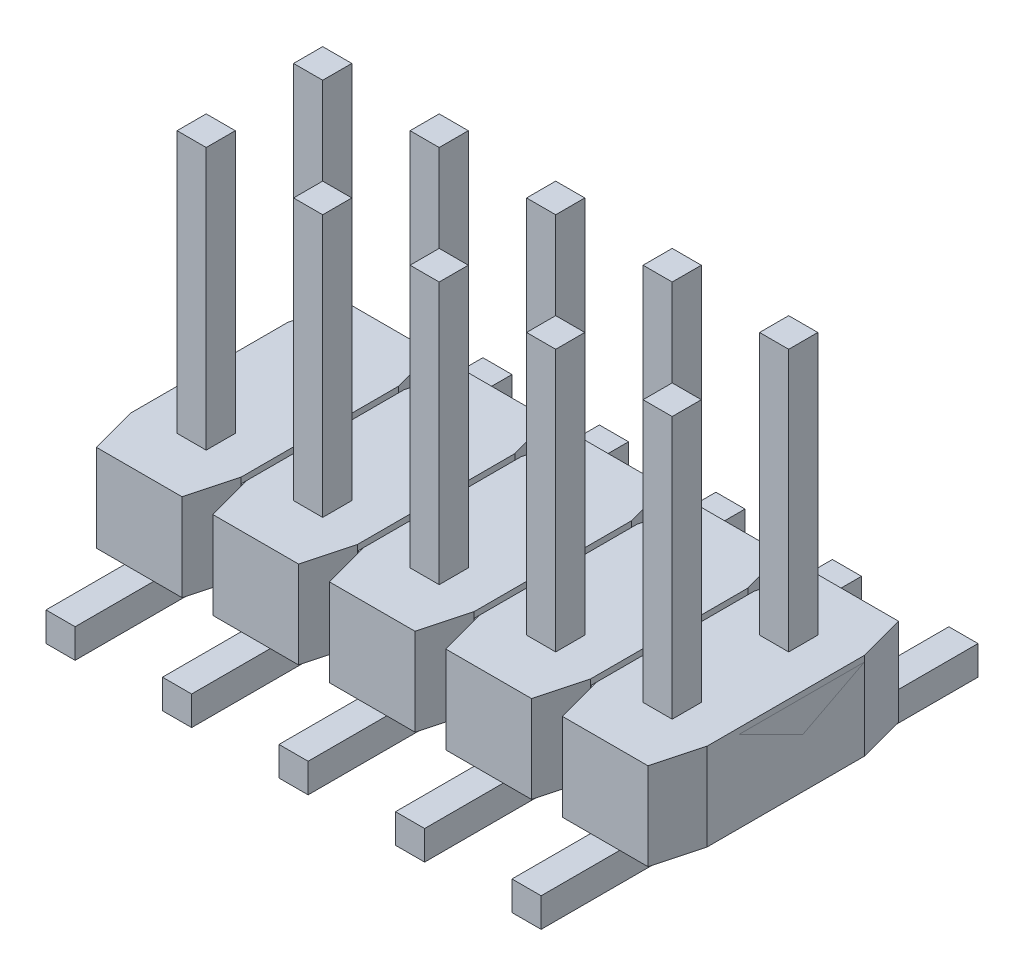
from build123d import *

# Parameters (mm, degrees)
CROQUIS1_W       = 0.5
CROQUIS1_H       = 0.5
EXTRUIR1_DEPTH   = 6.5
CROQUIS2_W       = 0.5
CROQUIS2_H       = 7.5
EXTRUIR2_DEPTH   = 0.5
CROQUIS3_W       = 0.5
CROQUIS3_H       = 0.5
EXTRUIR4_DEPTH   = 1.5
EXTRUIR4_2_DEPTH = 1.5
EXTRUIR4_3_DEPTH = 1.5
EXTRUIR4_4_DEPTH = 1.5
EXTRUIR4_5_DEPTH = 1.5
CROQUIS4_W       = 9.9
CROQUIS4_H       = 2.7
EXTRUIR5_DEPTH   = 1.4


with BuildPart() as part:
    # Croquis1 → Extruir1 (new body)
    with BuildSketch(Plane(origin=(0, 0, 0), x_dir=(1, 0, 0), z_dir=(0, 1, 0))):
        with Locations((2.25, 0.25)):
            Rectangle(CROQUIS1_W, CROQUIS1_H)
        with Locations((0.25, 0.25)):
            Rectangle(CROQUIS1_W, CROQUIS1_H)
        with Locations((4.25, 0.25)):
            Rectangle(CROQUIS1_W, CROQUIS1_H)
        with Locations((6.25, 0.25)):
            Rectangle(CROQUIS1_W, CROQUIS1_H)
        with Locations((8.25, 0.25)):
            Rectangle(CROQUIS1_W, CROQUIS1_H)
        with Locations((0.25, 2.25)):
            Rectangle(CROQUIS1_W, CROQUIS1_H)
        with Locations((2.25, 2.25)):
            Rectangle(CROQUIS1_W, CROQUIS1_H)
        with Locations((4.25, 2.25)):
            Rectangle(CROQUIS1_W, CROQUIS1_H)
        with Locations((6.25, 2.25)):
            Rectangle(CROQUIS1_W, CROQUIS1_H)
        with Locations((8.25, 2.25)):
            Rectangle(CROQUIS1_W, CROQUIS1_H)
    extrude(amount=EXTRUIR1_DEPTH)

    # Croquis2 → Extruir2 (add)
    with BuildSketch(Plane.XZ):
        with Locations((2.25, -1.5)):
            Rectangle(CROQUIS2_W, CROQUIS2_H)
        with Locations((0.25, -1.5)):
            Rectangle(CROQUIS2_W, CROQUIS2_H)
        with Locations((4.25, -1.5)):
            Rectangle(CROQUIS2_W, CROQUIS2_H)
        with Locations((6.25, -1.5)):
            Rectangle(CROQUIS2_W, CROQUIS2_H)
        with Locations((8.25, -1.5)):
            Rectangle(CROQUIS2_W, CROQUIS2_H)
    extrude(amount=-EXTRUIR2_DEPTH)


with BuildPart() as body_2:
    # Croquis3 → Extruir4 (new body)
    with BuildSketch(Plane(origin=(0, 0.5, 0), x_dir=(-1, 0, 0), z_dir=(0, 1, 0))):
        Polygon((-0.985640646, -3.4), (0.485640646, -3.4), (0.7, -2.6), (0.7, 0.1), (0.485640646, 0.9), (-0.985640646, 0.9), (-1.2, 0.1), (-1.2, -2.6), align=None)
        with Locations((-0.25, -2.25)):
            Rectangle(CROQUIS3_W, CROQUIS3_H, mode=Mode.SUBTRACT)
        with Locations((-0.25, -0.25)):
            Rectangle(CROQUIS3_W, CROQUIS3_H, mode=Mode.SUBTRACT)
    extrude(amount=EXTRUIR4_DEPTH)


with BuildPart() as body_3:
    # Croquis3 → Extruir4 2 (new body)
    with BuildSketch(Plane(origin=(0, 0.5, 0), x_dir=(-1, 0, 0), z_dir=(0, 1, 0))):
        Polygon((-2.985640646, -3.4), (-1.514359354, -3.4), (-1.3, -2.6), (-1.3, 0.1), (-1.514359354, 0.9), (-2.985640646, 0.9), (-3.2, 0.1), (-3.2, -2.6), align=None)
        with Locations((-2.25, -2.25)):
            Rectangle(CROQUIS3_W, CROQUIS3_H, mode=Mode.SUBTRACT)
        with Locations((-2.25, -0.25)):
            Rectangle(CROQUIS3_W, CROQUIS3_H, mode=Mode.SUBTRACT)
    extrude(amount=EXTRUIR4_2_DEPTH)


with BuildPart() as body_4:
    # Croquis3 → Extruir4 3 (new body)
    with BuildSketch(Plane(origin=(0, 0.5, 0), x_dir=(-1, 0, 0), z_dir=(0, 1, 0))):
        Polygon((-4.985640646, -3.4), (-3.514359354, -3.4), (-3.3, -2.6), (-3.3, 0.1), (-3.514359354, 0.9), (-4.985640646, 0.9), (-5.2, 0.1), (-5.2, -2.6), align=None)
        with Locations((-4.25, -2.25)):
            Rectangle(CROQUIS3_W, CROQUIS3_H, mode=Mode.SUBTRACT)
        with Locations((-4.25, -0.25)):
            Rectangle(CROQUIS3_W, CROQUIS3_H, mode=Mode.SUBTRACT)
    extrude(amount=EXTRUIR4_3_DEPTH)


with BuildPart() as body_5:
    # Croquis3 → Extruir4 4 (new body)
    with BuildSketch(Plane(origin=(0, 0.5, 0), x_dir=(-1, 0, 0), z_dir=(0, 1, 0))):
        Polygon((-6.985640646, -3.4), (-5.514359354, -3.4), (-5.3, -2.6), (-5.3, 0.1), (-5.514359354, 0.9), (-6.985640646, 0.9), (-7.2, 0.1), (-7.2, -2.6), align=None)
        with Locations((-6.25, -2.25)):
            Rectangle(CROQUIS3_W, CROQUIS3_H, mode=Mode.SUBTRACT)
        with Locations((-6.25, -0.25)):
            Rectangle(CROQUIS3_W, CROQUIS3_H, mode=Mode.SUBTRACT)
    extrude(amount=EXTRUIR4_4_DEPTH)


with BuildPart() as body_6:
    # Croquis3 → Extruir4 5 (new body)
    with BuildSketch(Plane(origin=(0, 0.5, 0), x_dir=(-1, 0, 0), z_dir=(0, 1, 0))):
        Polygon((-8.985640646, -3.4), (-7.514359354, -3.4), (-7.3, -2.6), (-7.3, 0.1), (-7.514359354, 0.9), (-8.985640646, 0.9), (-9.2, 0.1), (-9.2, -2.6), align=None)
        with Locations((-8.25, -2.25)):
            Rectangle(CROQUIS3_W, CROQUIS3_H, mode=Mode.SUBTRACT)
        with Locations((-8.25, -0.25)):
            Rectangle(CROQUIS3_W, CROQUIS3_H, mode=Mode.SUBTRACT)
    extrude(amount=EXTRUIR4_5_DEPTH)


with BuildPart() as body_7:
    # Croquis4 → Extruir5 (new body)
    with BuildSketch(Plane.XZ.offset(-0.5)):
        with Locations((4.25, -1.25)):
            Rectangle(CROQUIS4_W, CROQUIS4_H)
    extrude(amount=-EXTRUIR5_DEPTH)


solid = Compound([part.part, body_2.part, body_3.part, body_4.part, body_5.part, body_6.part, body_7.part])
